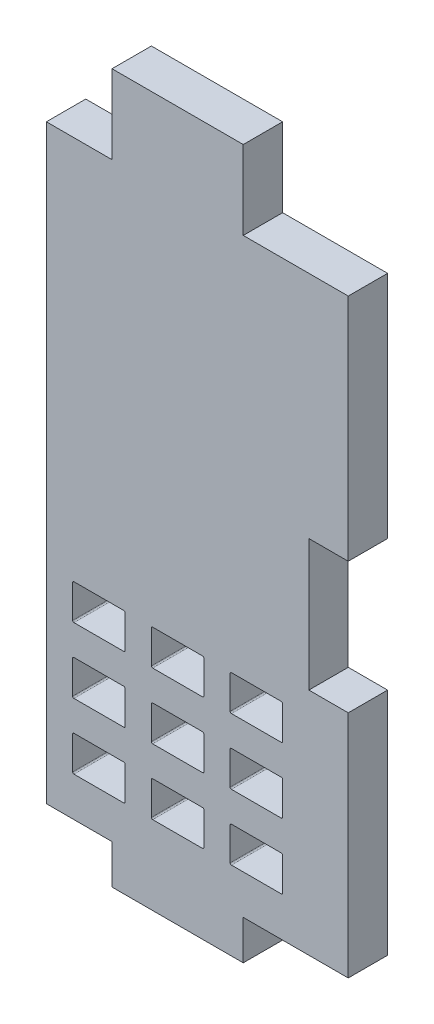
from build123d import *

# Parameters (mm, degrees)
BOSS_EXTRUDE1_DEPTH = 3
CUT_EXTRUDE1_DEPTH  = 57.026779311


with BuildPart() as part:
    # Sketch1 → Boss-Extrude1 (new body)
    with BuildSketch(Plane.XY):
        Polygon((0, 0), (0, 45), (5, 45), (5, 51), (15, 51), (15, 45), (23, 45), (23, 27.5), (20, 27.5), (20, 17.5), (23, 17.5), (23, 0), (15, 0), (15, -3), (5, -3), (5, 0), align=None)
    extrude(amount=BOSS_EXTRUDE1_DEPTH)

    # Sketch2 → Cut-Extrude1 (cut, through all)
    with BuildSketch(Plane(origin=(0, 0, 0), x_dir=(-1, 0, 0), z_dir=(0, 0, -1))):
        with BuildLine():
            Line((-2.1, 3), (-5.9, 3))
            ThreePointArc((-5.9, 3), (-5.970710678, 3.029289322), (-6, 3.1))
            Line((-6, 3.1), (-6, 5.6))
            ThreePointArc((-6, 5.6), (-5.970710678, 5.670710678), (-5.9, 5.7))
            Line((-5.9, 5.7), (-2.1, 5.7))
            ThreePointArc((-2.1, 5.7), (-2.029289322, 5.670710678), (-2, 5.6))
            Line((-2, 5.6), (-2, 3.1))
            ThreePointArc((-2, 3.1), (-2.029289322, 3.029289322), (-2.1, 3))
        make_face()
        with BuildLine():
            Line((-8.1, 3), (-11.9, 3))
            ThreePointArc((-11.9, 3), (-11.970710678, 3.029289322), (-12, 3.1))
            Line((-12, 3.1), (-12, 5.6))
            ThreePointArc((-12, 5.6), (-11.970710678, 5.670710678), (-11.9, 5.7))
            Line((-11.9, 5.7), (-8.1, 5.7))
            ThreePointArc((-8.1, 5.7), (-8.029289322, 5.670710678), (-8, 5.6))
            Line((-8, 5.6), (-8, 3.1))
            ThreePointArc((-8, 3.1), (-8.029289322, 3.029289322), (-8.1, 3))
        make_face()
        with BuildLine():
            Line((-14.1, 3), (-17.9, 3))
            ThreePointArc((-17.9, 3), (-17.970710678, 3.029289322), (-18, 3.1))
            Line((-18, 3.1), (-18, 5.6))
            ThreePointArc((-18, 5.6), (-17.970710678, 5.670710678), (-17.9, 5.7))
            Line((-17.9, 5.7), (-14.1, 5.7))
            ThreePointArc((-14.1, 5.7), (-14.029289322, 5.670710678), (-14, 5.6))
            Line((-14, 5.6), (-14, 3.1))
            ThreePointArc((-14, 3.1), (-14.029289322, 3.029289322), (-14.1, 3))
        make_face()
        with BuildLine():
            Line((-8.1, 8), (-11.9, 8))
            ThreePointArc((-11.9, 8), (-11.970710678, 8.029289322), (-12, 8.1))
            Line((-12, 8.1), (-12, 10.6))
            ThreePointArc((-12, 10.6), (-11.970710678, 10.670710678), (-11.9, 10.7))
            Line((-11.9, 10.7), (-8.1, 10.7))
            ThreePointArc((-8.1, 10.7), (-8.029289322, 10.670710678), (-8, 10.6))
            Line((-8, 10.6), (-8, 8.1))
            ThreePointArc((-8, 8.1), (-8.029289322, 8.029289322), (-8.1, 8))
        make_face()
        with BuildLine():
            Line((-14.1, 8), (-17.9, 8))
            ThreePointArc((-17.9, 8), (-17.970710678, 8.029289322), (-18, 8.1))
            Line((-18, 8.1), (-18, 10.6))
            ThreePointArc((-18, 10.6), (-17.970710678, 10.670710678), (-17.9, 10.7))
            Line((-17.9, 10.7), (-14.1, 10.7))
            ThreePointArc((-14.1, 10.7), (-14.029289322, 10.670710678), (-14, 10.6))
            Line((-14, 10.6), (-14, 8.1))
            ThreePointArc((-14, 8.1), (-14.029289322, 8.029289322), (-14.1, 8))
        make_face()
        with BuildLine():
            Line((-8.1, 13), (-11.9, 13))
            ThreePointArc((-11.9, 13), (-11.970710678, 13.029289322), (-12, 13.1))
            Line((-12, 13.1), (-12, 15.6))
            ThreePointArc((-12, 15.6), (-11.970710678, 15.670710678), (-11.9, 15.7))
            Line((-11.9, 15.7), (-8.1, 15.7))
            ThreePointArc((-8.1, 15.7), (-8.029289322, 15.670710678), (-8, 15.6))
            Line((-8, 15.6), (-8, 13.1))
            ThreePointArc((-8, 13.1), (-8.029289322, 13.029289322), (-8.1, 13))
        make_face()
        with BuildLine():
            Line((-14.1, 13), (-17.9, 13))
            ThreePointArc((-17.9, 13), (-17.970710678, 13.029289322), (-18, 13.1))
            Line((-18, 13.1), (-18, 15.6))
            ThreePointArc((-18, 15.6), (-17.970710678, 15.670710678), (-17.9, 15.7))
            Line((-17.9, 15.7), (-14.1, 15.7))
            ThreePointArc((-14.1, 15.7), (-14.029289322, 15.670710678), (-14, 15.6))
            Line((-14, 15.6), (-14, 13.1))
            ThreePointArc((-14, 13.1), (-14.029289322, 13.029289322), (-14.1, 13))
        make_face()
        with BuildLine():
            Line((-2.1, 8), (-5.9, 8))
            ThreePointArc((-5.9, 8), (-5.970710678, 8.029289322), (-6, 8.1))
            Line((-6, 8.1), (-6, 10.6))
            ThreePointArc((-6, 10.6), (-5.970710678, 10.670710678), (-5.9, 10.7))
            Line((-5.9, 10.7), (-2.1, 10.7))
            ThreePointArc((-2.1, 10.7), (-2.029289322, 10.670710678), (-2, 10.6))
            Line((-2, 10.6), (-2, 8.1))
            ThreePointArc((-2, 8.1), (-2.029289322, 8.029289322), (-2.1, 8))
        make_face()
        with BuildLine():
            Line((-2.1, 13), (-5.9, 13))
            ThreePointArc((-5.9, 13), (-5.970710678, 13.029289322), (-6, 13.1))
            Line((-6, 13.1), (-6, 15.6))
            ThreePointArc((-6, 15.6), (-5.970710678, 15.670710678), (-5.9, 15.7))
            Line((-5.9, 15.7), (-2.1, 15.7))
            ThreePointArc((-2.1, 15.7), (-2.029289322, 15.670710678), (-2, 15.6))
            Line((-2, 15.6), (-2, 13.1))
            ThreePointArc((-2, 13.1), (-2.029289322, 13.029289322), (-2.1, 13))
        make_face()
    extrude(amount=-CUT_EXTRUDE1_DEPTH, mode=Mode.SUBTRACT)


solid = part.part
